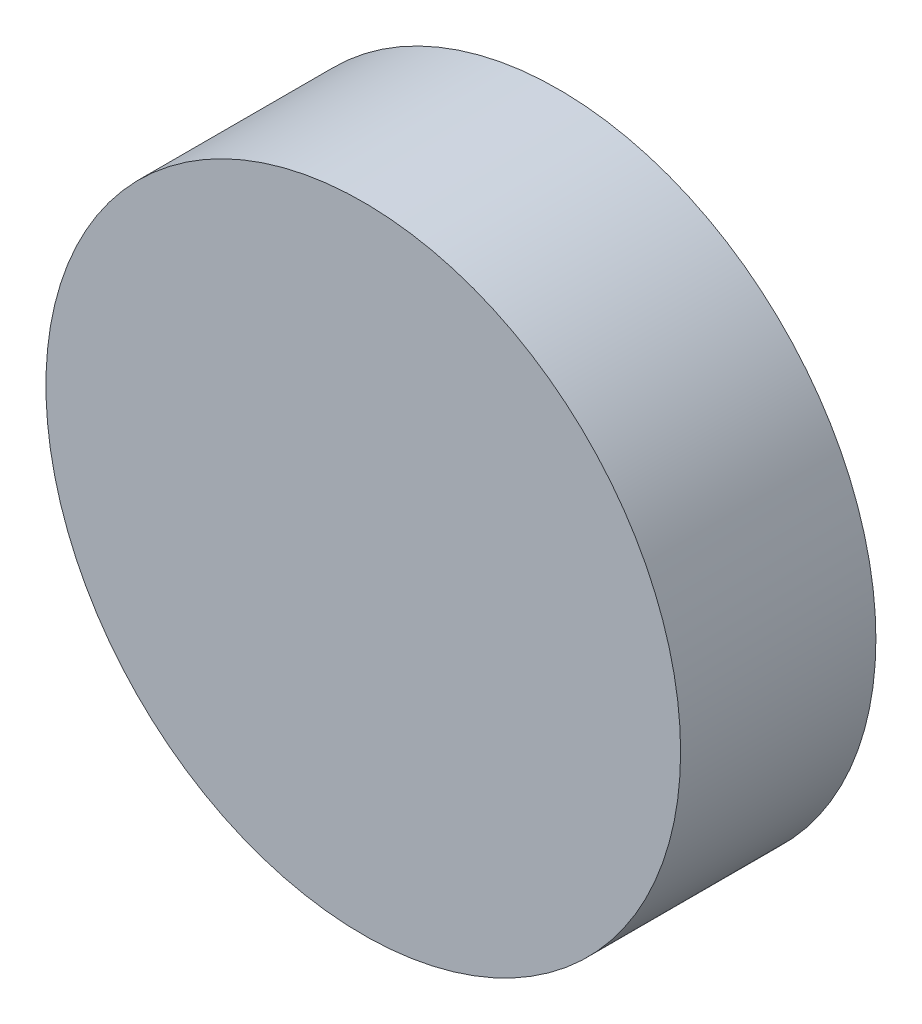
from build123d import *

# Parameters (mm, degrees)
SKETCH_1_R      = 32.5
EXTRUDE_1_DEPTH = 20


with BuildPart() as part:
    # 草图1 → 凸台-拉伸1 (new body)
    with BuildSketch(Plane.XY):
        Circle(SKETCH_1_R)
    extrude(amount=EXTRUDE_1_DEPTH)


solid = part.part
